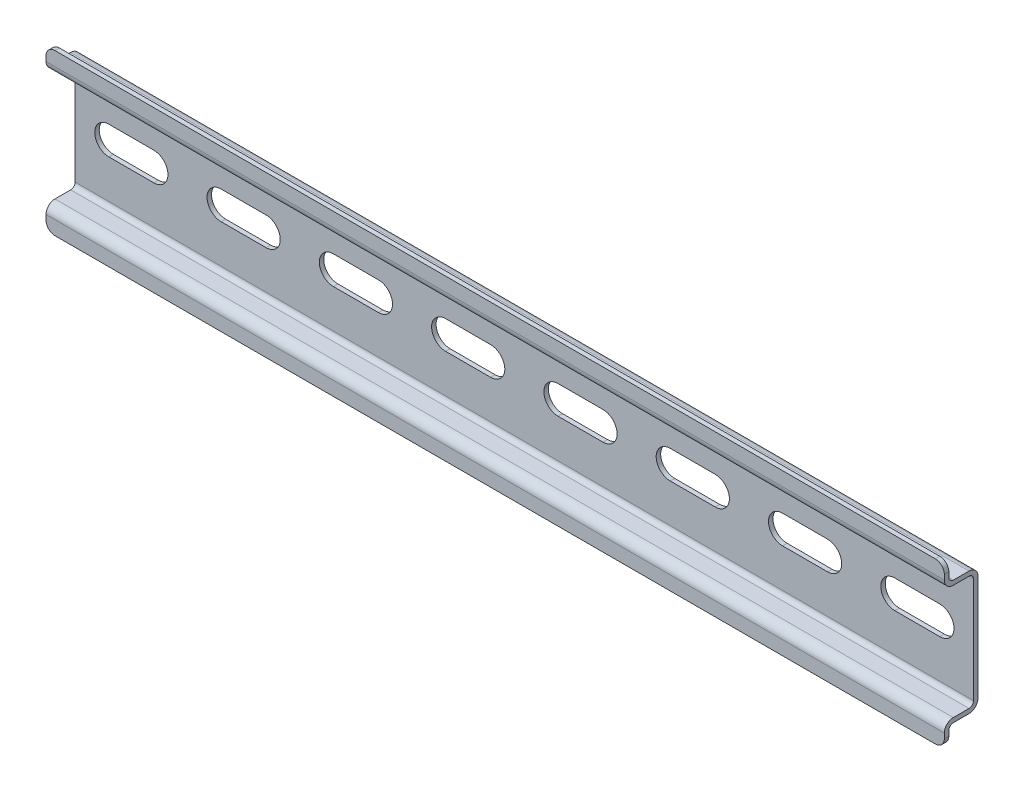
from build123d import *

# Parameters (mm, degrees)
BOSS_EXTRUDE1_DEPTH = 200
CUT_EXTRUDE1_DEPTH  = 204.299631087
LPATTERN1_COUNT     = 10
LPATTERN1_PITCH     = 25
FILLET1_R           = 2


with BuildPart() as part:
    # Sketch1 → Boss-Extrude1 (new body)
    with BuildSketch(Plane(origin=(0, 0, 0), x_dir=(0, 0, -1), z_dir=(1, 0, 0))):
        with BuildLine():
            Line((0, 0), (0, 3.1))
            ThreePointArc((0, 3.1), (0.585786438, 4.514213562), (2, 5.1))
            Line((2, 5.1), (5.5, 5.1))
            ThreePointArc((5.5, 5.1), (6.207106781, 5.392893219), (6.5, 6.1))
            Line((6.5, 6.1), (6.5, 29.6))
            ThreePointArc((6.5, 29.6), (6.207106781, 30.307106781), (5.5, 30.6))
            Line((5.5, 30.6), (2, 30.6))
            ThreePointArc((2, 30.6), (0.585786438, 31.185786438), (0, 32.6))
            Line((0, 32.6), (0, 35.7))
            Line((0, 35.7), (1, 35.7))
            Line((1, 35.7), (1, 32.6))
            ThreePointArc((1, 32.6), (1.292893219, 31.892893219), (2, 31.6))
            Line((2, 31.6), (5.5, 31.6))
            ThreePointArc((5.5, 31.6), (6.914213562, 31.014213562), (7.5, 29.6))
            Line((7.5, 29.6), (7.5, 6.1))
            ThreePointArc((7.5, 6.1), (6.914213562, 4.685786438), (5.5, 4.1))
            Line((5.5, 4.1), (2, 4.1))
            ThreePointArc((2, 4.1), (1.292893219, 3.807106781), (1, 3.1))
            Line((1, 3.1), (1, 0))
            Line((1, 0), (0, 0))
        make_face()
    extrude(amount=BOSS_EXTRUDE1_DEPTH)

    # Sketch2 → Cut-Extrude1 (cut, through all)
    with BuildSketch(Plane.XY):
        with BuildLine():
            Line((7.5, 21), (17.5, 21))
            ThreePointArc((17.5, 21), (20.65, 17.85), (17.5, 14.7))
            Line((17.5, 14.7), (7.5, 14.7))
            ThreePointArc((7.5, 14.7), (4.35, 17.85), (7.5, 21))
        make_face()
    cut_extrude1 = extrude(amount=-CUT_EXTRUDE1_DEPTH, mode=Mode.SUBTRACT)

    # LPattern1: Cut-Extrude1 ×10
    with Locations(*[(i * LPATTERN1_PITCH, 0, 0) for i in range(1, LPATTERN1_COUNT)]):
        add(cut_extrude1, mode=Mode.SUBTRACT)

    # Fillet1
    fillet1_edges = [part.edges().sort_by_distance(p)[0] for p in [
        (0, 35.7, -0.5),
        (0, 0, -0.5),
        (200, 35.7, -0.5),
        (200, 0, -0.5),
    ]]
    fillet(fillet1_edges, radius=FILLET1_R)


solid = part.part
